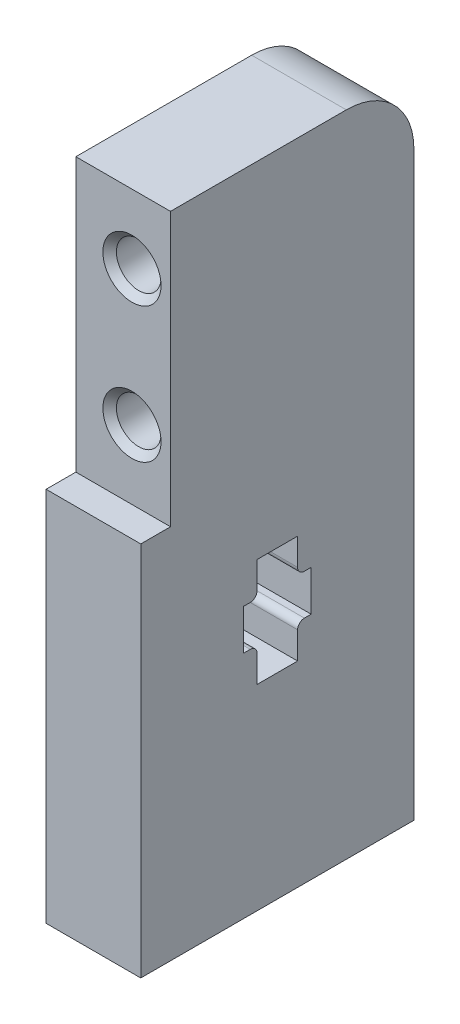
from build123d import *

# Parameters (mm, degrees)
CROQUIS1_W              = 20.2
CROQUIS1_H              = 48
SALIENTE_EXTRUIR1_DEPTH = 7
CROQUIS2_W              = 7
CROQUIS2_H              = 20.2
CORTAR_EXTRUIR1_DEPTH   = 2.2
CROQUIS3_R              = 1.62
CROQUIS3_R_2            = 1.65
CORTAR_EXTRUIR2_DEPTH   = 15
CROQUIS4_R              = 1.65
CORTAR_EXTRUIR3_DEPTH   = 15
CHAFL_N1_SIZE           = 0.5
REDONDEO1_R             = 5
CROQUIS5_W              = 5
CROQUIS5_H              = 3
CORTAR_EXTRUIR4_DEPTH   = 7
CROQUIS6_W              = 3
CROQUIS6_H              = 2.5
CORTAR_EXTRUIR5_DEPTH   = 7
REDONDEO2_R             = 0.5


with BuildPart() as part:
    # Croquis1 → Saliente-Extruir1 (new body)
    with BuildSketch(Plane(origin=(0, 0, 0), x_dir=(0, 0, -1), z_dir=(1, 0, 0))):
        with Locations((10.1, 24)):
            Rectangle(CROQUIS1_W, CROQUIS1_H)
    extrude(amount=SALIENTE_EXTRUIR1_DEPTH)

    # Croquis2 → Cortar-Extruir1 (cut)
    with BuildSketch(Plane.XY):
        with Locations((3.5, 37.9)):
            Rectangle(CROQUIS2_W, CROQUIS2_H)
    extrude(amount=-CORTAR_EXTRUIR1_DEPTH, mode=Mode.SUBTRACT)

    # Croquis3 → Cortar-Extruir2 (cut)
    with BuildSketch(Plane.XZ):
        with Locations(Location((4.15, -5.1, 0), (0, 0, 270))):
            Circle(CROQUIS3_R)
        with Locations(Location((4.15, -15.1, 0), (0, 0, 270))):
            Circle(CROQUIS3_R_2)
    extrude(amount=-CORTAR_EXTRUIR2_DEPTH, mode=Mode.SUBTRACT)

    # Croquis4 → Cortar-Extruir3 (cut)
    with BuildSketch(Plane.XY.offset(-2.2)):
        with Locations((4.15, 32.9)):
            Circle(CROQUIS4_R)
        with Locations((4.15, 42.9)):
            Circle(CROQUIS4_R)
    extrude(amount=-CORTAR_EXTRUIR3_DEPTH, mode=Mode.SUBTRACT)

    # Chaflán1
    chafl_n1_edges = [part.edges().sort_by_distance(p)[0] for p in [
        (4.15, 0, -3.48),
        (4.15, 0, -13.45),
        (2.5, 42.9, -2.2),
        (2.5, 32.9, -2.2),
    ]]
    chamfer(chafl_n1_edges, length=CHAFL_N1_SIZE)

    # Redondeo1
    redondeo1_edges = [part.edges().sort_by_distance(p)[0] for p in [
        (3.5, 48, -20.2),
    ]]
    fillet(redondeo1_edges, radius=REDONDEO1_R)

    # Croquis5 → Cortar-Extruir4 (cut)
    with BuildSketch(Plane(origin=(7, 0, 0), x_dir=(0, 0, -1), z_dir=(1, 0, 0))):
        with Locations((10.1, 18.5)):
            Rectangle(CROQUIS5_W, CROQUIS5_H)
    extrude(amount=-CORTAR_EXTRUIR4_DEPTH, mode=Mode.SUBTRACT)

    # Croquis6 → Cortar-Extruir5 (cut)
    with BuildSketch(Plane(origin=(7, 0, 0), x_dir=(0, 0, -1), z_dir=(1, 0, 0))):
        with Locations((10.1, 21.25)):
            Rectangle(CROQUIS6_W, CROQUIS6_H)
        with Locations((10.1, 15.75)):
            Rectangle(CROQUIS6_W, CROQUIS6_H)
    extrude(amount=-CORTAR_EXTRUIR5_DEPTH, mode=Mode.SUBTRACT)

    # Redondeo2
    redondeo2_edges = [part.edges().sort_by_distance(p)[0] for p in [
        (3.5, 17, -8.6),
        (3.5, 20, -8.6),
        (3.5, 20, -11.6),
        (3.5, 17, -11.6),
    ]]
    fillet(redondeo2_edges, radius=REDONDEO2_R)


solid = part.part
